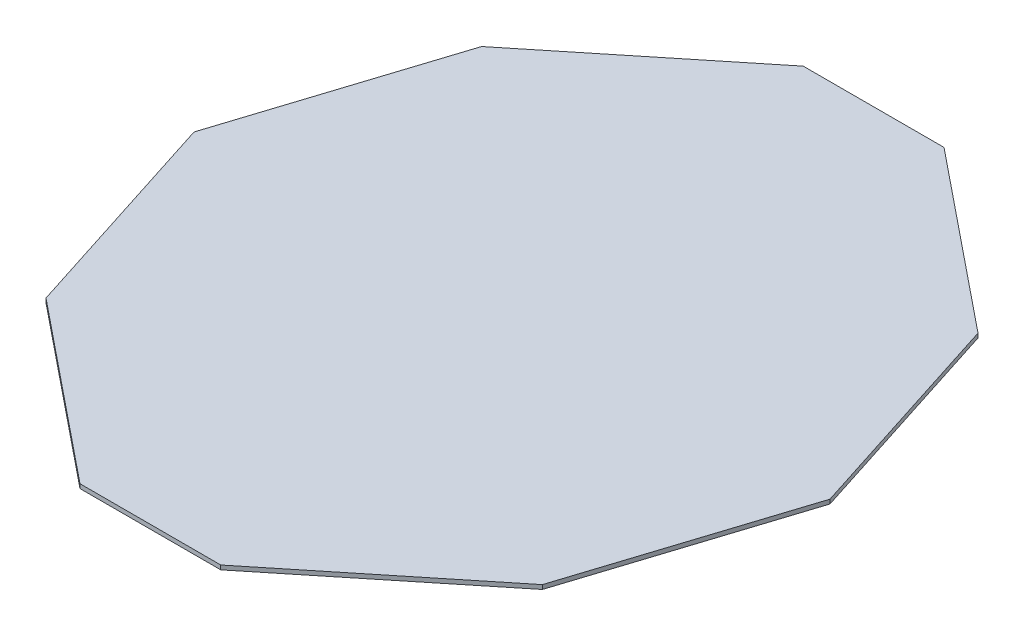
from build123d import *

# Parameters (mm, degrees)
BOSS_EXTRUDE1_DEPTH = 0.24


with BuildPart() as part:
    # Sketch1 → Boss-Extrude1 (new body)
    with BuildSketch(Plane(origin=(0, 0, 0), x_dir=(1, 0, 0), z_dir=(0, 1, 0))):
        Polygon((0, 0), (8, 0), (18.10757214, 8.175389008), (22.073789715, 20.555579562), (18.10757214, 32.935770116), (8, 41.111159124), (0, 41.111159124), (-10.10757214, 32.935770116), (-14.073789715, 20.555579562), (-10.10757214, 8.175389008), align=None)
    extrude(amount=BOSS_EXTRUDE1_DEPTH)


solid = part.part
